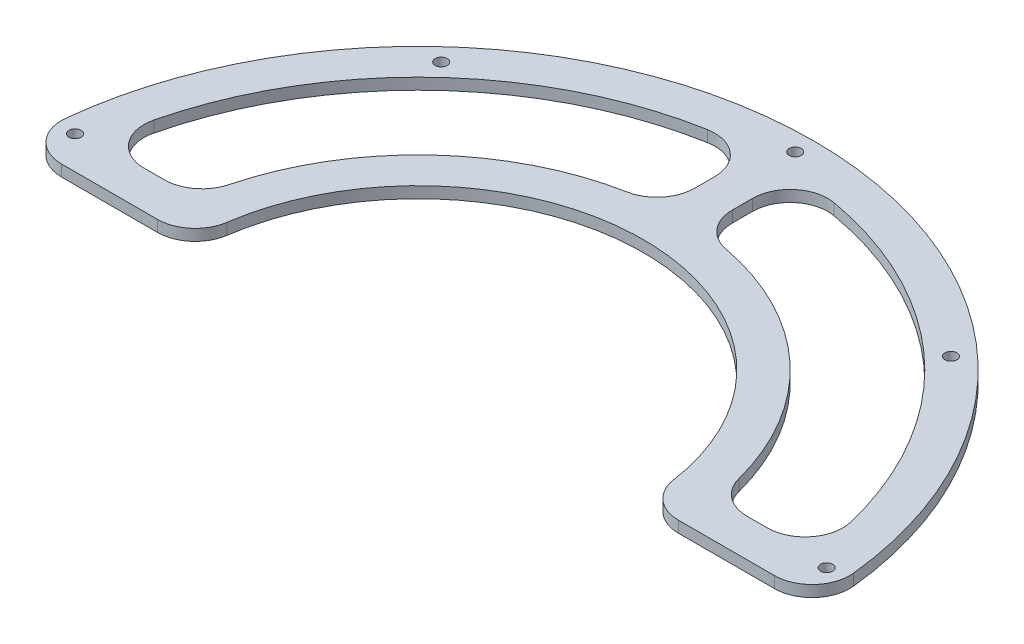
from build123d import *

# Parameters (mm, degrees)
SKETCH_2_R      = 1.6
EXTRUDE_1_DEPTH = 3


with BuildPart() as part:
    # 草图2 → 凸台-拉伸1 (new body)
    with BuildSketch(Plane(origin=(0, 0, 0), x_dir=(1, 0, 0), z_dir=(0, 1, 0))):
        with BuildLine():
            Line((-94.472218138, 0), (-69.049640839, 0))
            ThreePointArc((-69.049640839, 0), (-62.504902792, 2.439153229), (-59.152888533, 8.56671922))
            ThreePointArc((-59.152888533, 8.56671922), (0, 59.77), (59.152888533, 8.56671922))
            ThreePointArc((59.152888533, 8.56671922), (62.504902792, 2.439153229), (69.049640839, 0))
            Line((69.049640839, 0), (94.472218138, 0))
            ThreePointArc((94.472218138, 0), (101.906137555, 3.311439459), (104.416662153, 11.052631579))
            ThreePointArc((104.416662153, 11.052631579), (0, 105), (-104.416662153, 11.052631579))
            ThreePointArc((-104.416662153, 11.052631579), (-101.906137555, 3.311439459), (-94.472218138, 0))
        make_face()
        with Locations(Location((0, 100, 0), (0, 0, 270))):
            Circle(SKETCH_2_R, mode=Mode.SUBTRACT)
        with Locations(Location((67.559020762, 73.727733681, 0), (0, 0, 270))):
            Circle(SKETCH_2_R, mode=Mode.SUBTRACT)
        with Locations(Location((99.619469809, 8.715574275, 0), (0, 0, 270))):
            Circle(SKETCH_2_R, mode=Mode.SUBTRACT)
        with Locations(Location((-67.559020762, 73.727733681, 0), (0, 0, 270))):
            Circle(SKETCH_2_R, mode=Mode.SUBTRACT)
        with Locations(Location((-99.619469809, 8.715574275, 0), (0, 0, 270))):
            Circle(SKETCH_2_R, mode=Mode.SUBTRACT)
        with BuildLine():
            Line((-82.613558209, 10), (-77.222101111, 10))
            ThreePointArc((-77.222101111, 10), (-71.101320206, 12.092026738), (-67.541506763, 17.492791776))
            ThreePointArc((-67.541506763, 17.492791776), (-47.72457253, 50.894185099), (-13.119593832, 68.525390606))
            ThreePointArc((-13.119593832, 68.525390606), (-7.292728703, 71.975349568), (-5, 78.347003133))
            Line((-5, 78.347003133), (-5, 83.666002653))
            ThreePointArc((-5, 83.666002653), (-8.583110521, 91.335652542), (-16.764705882, 93.509061789))
            ThreePointArc((-16.764705882, 93.509061789), (-65.125761737, 69.163828395), (-92.332800352, 22.352941176))
            ThreePointArc((-92.332800352, 22.352941176), (-90.472610689, 13.816530576), (-82.613558209, 10))
        make_face(mode=Mode.SUBTRACT)
        with BuildLine():
            Line((77.222101111, 10), (82.613558209, 10))
            ThreePointArc((82.613558209, 10), (90.472610689, 13.816530576), (92.332800352, 22.352941176))
            ThreePointArc((92.332800352, 22.352941176), (65.125761737, 69.163828395), (16.764705882, 93.509061789))
            ThreePointArc((16.764705882, 93.509061789), (8.583110521, 91.335652542), (5, 83.666002653))
            Line((5, 83.666002653), (5, 78.347003133))
            ThreePointArc((5, 78.347003133), (7.292728703, 71.975349568), (13.119593832, 68.525390606))
            ThreePointArc((13.119593832, 68.525390606), (47.72457253, 50.894185099), (67.541506763, 17.492791776))
            ThreePointArc((67.541506763, 17.492791776), (71.101320206, 12.092026738), (77.222101111, 10))
        make_face(mode=Mode.SUBTRACT)
    extrude(amount=EXTRUDE_1_DEPTH)


solid = part.part
